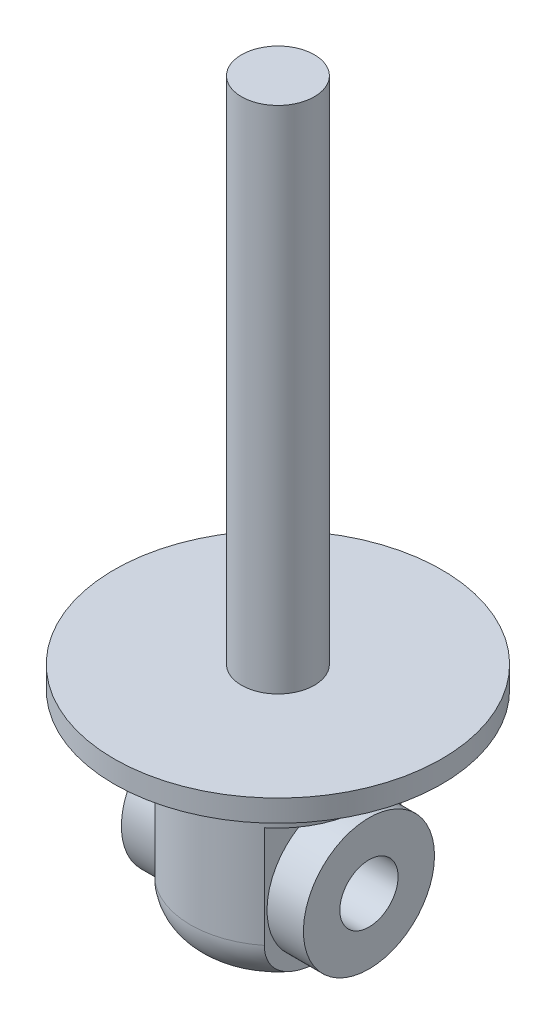
from build123d import *
from build123d.topology import SkipClean

# Parameters (mm, degrees)
SKETCH2_R               = 22.5
BOSS_EXTRUDE1_DEPTH     = 3
SKETCH3_R               = 5
BOSS_EXTRUDE2_DEPTH     = 70
SKETCH4_R               = 12
BOSS_EXTRUDE3_DEPTH     = 28
FILLET1_R               = 6
CUT_EXTRUDE1_DEPTH      = 80.633535649
CUT_EXTRUDE1_DEPTH_BACK = 80.633535649
SKETCH5_W               = 20
SKETCH5_H               = 20
CUT_EXTRUDE2_DEPTH      = 83.068568892
CUT_EXTRUDE2_DEPTH_BACK = 83.068568892
SKETCH6_R               = 4
SKETCH7_R               = 9
SKETCH7_R_2             = 4
BOSS_EXTRUDE4_DEPTH     = 12.5


with BuildPart() as part:
    # Sketch2 → Boss-Extrude1 (new body)
    with BuildSketch(Plane(origin=(0, 0, 0), x_dir=(1, 0, 0), z_dir=(0, 1, 0))):
        with Locations(Location((0, 0, 0), (0, 0, 270))):
            Circle(SKETCH2_R)
    extrude(amount=BOSS_EXTRUDE1_DEPTH)

    # Sketch3 → Boss-Extrude2 (add)
    with BuildSketch(Plane(origin=(0, 3, 0), x_dir=(1, 0, 0), z_dir=(0, 1, 0))):
        with Locations(Location((0, 0, 0), (0, 0, 270))):
            Circle(SKETCH3_R)
    extrude(amount=BOSS_EXTRUDE2_DEPTH)

    # Sketch4 → Boss-Extrude3 (add)
    with BuildSketch(Plane.XZ):
        with Locations(Location((0, 0, 0), (0, 0, 90))):
            Circle(SKETCH4_R)
    extrude(amount=BOSS_EXTRUDE3_DEPTH)

    # Fillet1
    fillet1_edges = [part.edges().sort_by_distance(p)[0] for p in [
        (0, -28, -12),
    ]]
    fillet(fillet1_edges, radius=FILLET1_R)

    # Sketch5 → Cut-Extrude1 (cut, two sides: drawn at the far end of the back side and taken through both)
    with BuildSketch(Plane.XY.offset(-CUT_EXTRUDE1_DEPTH_BACK)):
        with Locations((17.5, -18)):
            Rectangle(SKETCH5_W, SKETCH5_H)
        with Locations((-17.5, -18)):
            Rectangle(SKETCH5_W, SKETCH5_H)
    extrude(amount=CUT_EXTRUDE1_DEPTH + CUT_EXTRUDE1_DEPTH_BACK, mode=Mode.SUBTRACT)

    # Sketch6 → Cut-Extrude2 (cut, two sides: drawn at the far end of the back side and taken through both)
    with BuildSketch(Plane(origin=(7.5, 0, 0), x_dir=(0, 0, -1), z_dir=(1, 0, 0)).offset(-CUT_EXTRUDE2_DEPTH_BACK)):
        with Locations(Location((0, -18, 0), (0, 0, 90))):
            Circle(SKETCH6_R)
    extrude(amount=CUT_EXTRUDE2_DEPTH + CUT_EXTRUDE2_DEPTH_BACK, mode=Mode.SUBTRACT)

    # Sketch7 → Boss-Extrude4 (add, symmetric)
    with SkipClean():  # the faces are left unmerged after this step: merging them gives an invalid solid
        with BuildSketch(Plane(origin=(0, 0, 0), x_dir=(0, 0, -1), z_dir=(1, 0, 0))):
            with Locations((0, -18)):
                Circle(SKETCH7_R)
            with Locations((0, -18)):
                Circle(SKETCH7_R_2, mode=Mode.SUBTRACT)
        extrude(amount=BOSS_EXTRUDE4_DEPTH, both=True)


solid = part.part
